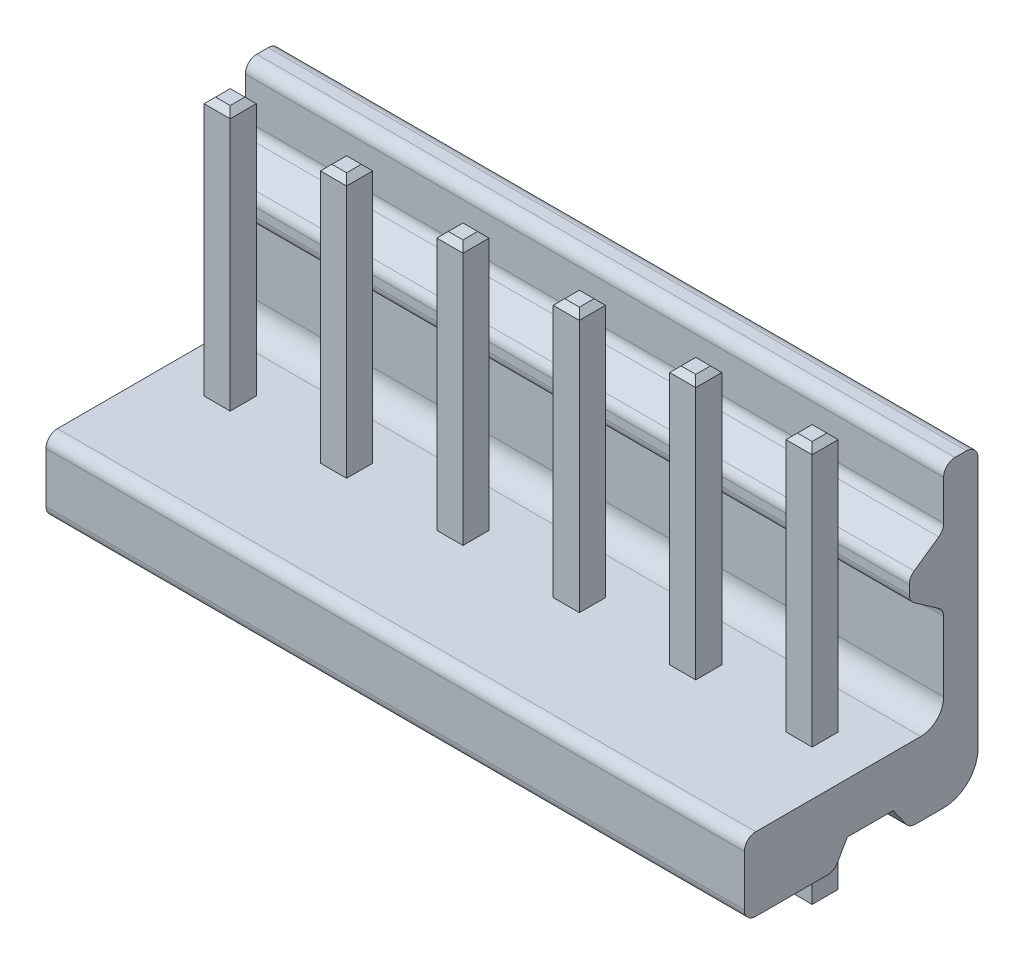
from build123d import *

# Parameters (mm, degrees)
BOSS_EXTRUDE1_DEPTH        = 30.48
SKETCH2_W                  = 1.14
SKETCH2_H                  = 1.14
BOSS_EXTRUDE2_DEPTH        = 17.5
CHAMFER1_SIZE              = 0.25
CHAMFER2_SIZE              = 0.25
LPATTERN3_COUNT            = 6
LPATTERN3_PITCH            = 5.08
CHAMFER1_OF_LPATTERN3_SIZE = 0.25
CHAMFER2_OF_LPATTERN3_SIZE = 0.25


with BuildPart() as part:
    # Sketch1 → Boss-Extrude1 (new body)
    with BuildSketch(Plane(origin=(0, 0, 0), x_dir=(0, 0, -1), z_dir=(1, 0, 0))):
        with BuildLine():
            Line((0, 2.7), (0, 0.5))
            ThreePointArc((0, 0.5), (0.146446609, 0.146446609), (0.5, 0))
            Line((0.5, 0), (3.633974596, 0))
            ThreePointArc((3.633974596, 0), (3.883974596, 0.066987298), (4.066987298, 0.25))
            Line((4.066987298, 0.25), (4.5, 1))
            Line((4.5, 1), (6.5, 1))
            Line((6.5, 1), (7.050915041, 0.213211782))
            ThreePointArc((7.050915041, 0.213211782), (7.229616757, 0.056494583), (7.460491063, 0))
            Line((7.460491063, 0), (8.7, 0))
            ThreePointArc((8.7, 0), (9.760660172, 0.439339828), (10.2, 1.5))
            Line((10.2, 1.5), (10.2, 12.5))
            ThreePointArc((10.2, 12.5), (10.053553391, 12.853553391), (9.7, 13))
            Line((9.7, 13), (9.2, 13))
            ThreePointArc((9.2, 13), (8.846446609, 12.853553391), (8.7, 12.5))
            Line((8.7, 12.5), (8.7, 10.760283525))
            ThreePointArc((8.7, 10.760283525), (8.643505417, 10.529409219), (8.486788218, 10.350707503))
            Line((8.486788218, 10.350707503), (7.413211782, 9.59898119))
            ThreePointArc((7.413211782, 9.59898119), (7.256494583, 9.420279474), (7.2, 9.189405167))
            Line((7.2, 9.189405167), (7.2, 8.810594833))
            ThreePointArc((7.2, 8.810594833), (7.256494583, 8.579720526), (7.413211782, 8.40101881))
            Line((7.413211782, 8.40101881), (8.486788218, 7.649292497))
            ThreePointArc((8.486788218, 7.649292497), (8.643505417, 7.470590781), (8.7, 7.239716475))
            Line((8.7, 7.239716475), (8.7, 4.2))
            ThreePointArc((8.7, 4.2), (8.407106781, 3.492893219), (7.7, 3.2))
            Line((7.7, 3.2), (0.5, 3.2))
            ThreePointArc((0.5, 3.2), (0.146446609, 3.053553391), (0, 2.7))
        make_face()
    extrude(amount=BOSS_EXTRUDE1_DEPTH)

    # Sketch2 → Boss-Extrude2 (add)
    with BuildSketch(Plane(origin=(0, -3, 0), x_dir=(-1, 0, 0), z_dir=(0, -1, 0))):
        with Locations((-27.94, 5.5)):
            Rectangle(SKETCH2_W, SKETCH2_H)
    boss_extrude2 = extrude(amount=-BOSS_EXTRUDE2_DEPTH)

    # Chamfer1
    chamfer1_edges = [part.edges().sort_by_distance(p)[0] for p in [
        (27.37, -3, -5.5),
        (27.94, -3, -6.07),
        (28.51, -3, -5.5),
        (27.94, -3, -4.93),
    ]]
    chamfer(chamfer1_edges, length=CHAMFER1_SIZE)

    # Chamfer2
    chamfer2_edges = [part.edges().sort_by_distance(p)[0] for p in [
        (27.37, 14.5, -5.5),
        (27.94, 14.5, -4.93),
        (28.51, 14.5, -5.5),
        (27.94, 14.5, -6.07),
    ]]
    chamfer(chamfer2_edges, length=CHAMFER2_SIZE)

    # LPattern3: Boss-Extrude2 ×6
    with Locations(*[(-i * LPATTERN3_PITCH, 0, 0) for i in range(1, LPATTERN3_COUNT)]):
        add(boss_extrude2)

    # Chamfer1 of LPattern3
    chamfer1_of_lpattern3_edges = [part.edges().sort_by_distance(p)[0] for p in [
        (22.29, -3, -5.5),
        (22.86, -3, -6.07),
        (23.43, -3, -5.5),
        (22.86, -3, -4.93),
        (17.21, -3, -5.5),
        (17.78, -3, -6.07),
        (18.35, -3, -5.5),
        (17.78, -3, -4.93),
        (12.13, -3, -5.5),
        (12.7, -3, -6.07),
        (13.27, -3, -5.5),
        (12.7, -3, -4.93),
        (7.05, -3, -5.5),
        (7.62, -3, -6.07),
        (8.19, -3, -5.5),
        (7.62, -3, -4.93),
        (1.97, -3, -5.5),
        (2.54, -3, -6.07),
        (3.11, -3, -5.5),
        (2.54, -3, -4.93),
    ]]
    chamfer(chamfer1_of_lpattern3_edges, length=CHAMFER1_OF_LPATTERN3_SIZE)

    # Chamfer2 of LPattern3
    chamfer2_of_lpattern3_edges = [part.edges().sort_by_distance(p)[0] for p in [
        (22.29, 14.5, -5.5),
        (22.86, 14.5, -4.93),
        (23.43, 14.5, -5.5),
        (22.86, 14.5, -6.07),
        (17.21, 14.5, -5.5),
        (17.78, 14.5, -4.93),
        (18.35, 14.5, -5.5),
        (17.78, 14.5, -6.07),
        (12.13, 14.5, -5.5),
        (12.7, 14.5, -4.93),
        (13.27, 14.5, -5.5),
        (12.7, 14.5, -6.07),
        (7.05, 14.5, -5.5),
        (7.62, 14.5, -4.93),
        (8.19, 14.5, -5.5),
        (7.62, 14.5, -6.07),
        (1.97, 14.5, -5.5),
        (2.54, 14.5, -4.93),
        (3.11, 14.5, -5.5),
        (2.54, 14.5, -6.07),
    ]]
    chamfer(chamfer2_of_lpattern3_edges, length=CHAMFER2_OF_LPATTERN3_SIZE)


solid = part.part
